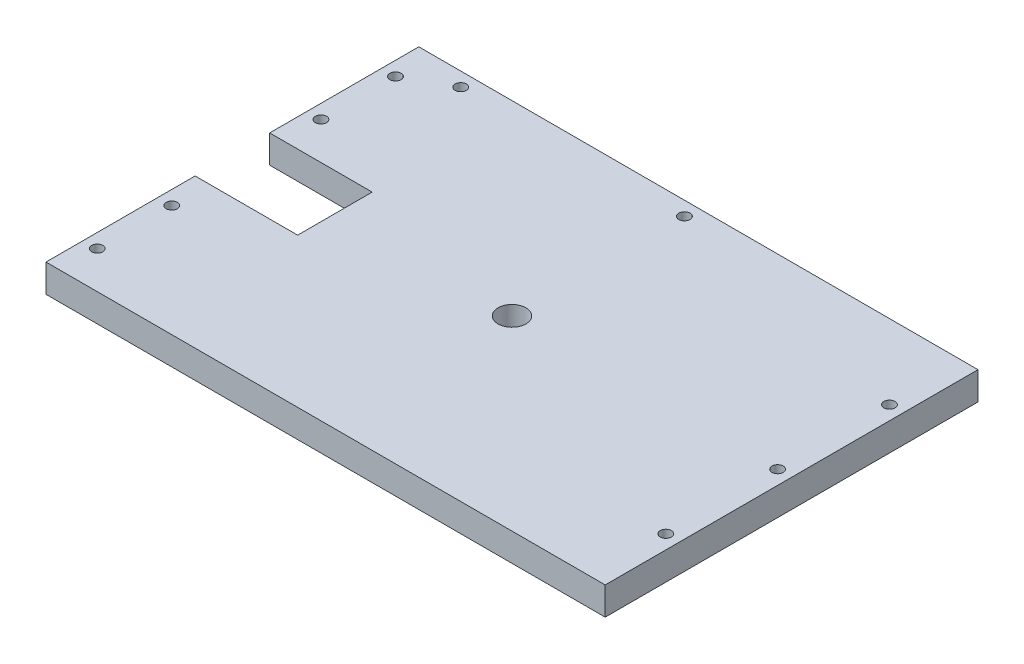
from build123d import *

# Parameters (mm, degrees)
SKETCH2_R           = 7.5
SKETCH2_R_2         = 3
BOSS_EXTRUDE2_DEPTH = 15


with BuildPart() as part:
    # Sketch2 → Boss-Extrude2 (new body)
    with BuildSketch(Plane(origin=(0, 0, 0), x_dir=(1, 0, 0), z_dir=(0, 1, 0))):
        Polygon((-168.032786885, 40.573770492), (131.967213115, 40.573770492), (131.967213115, -159.426229508), (-168.032786885, -159.426229508), (-168.032786885, -79.426229508), (-113.032786885, -79.426229508), (-113.032786885, -39.426229508), (-168.032786885, -39.426229508), align=None)
        with Locations(Location((-18.032786885, -59.426229508, 0), (0, 0, 270))):
            Circle(SKETCH2_R, mode=Mode.SUBTRACT)
        with Locations(Location((-160.532786885, 20.573770492, 0), (0, 0, 270))):
            Circle(SKETCH2_R_2, mode=Mode.SUBTRACT)
        with Locations(Location((-160.532786885, -19.426229508, 0), (0, 0, 90))):
            Circle(SKETCH2_R_2, mode=Mode.SUBTRACT)
        with Locations(Location((-160.532786885, -139.426229508, 0), (0, 0, 270))):
            Circle(SKETCH2_R_2, mode=Mode.SUBTRACT)
        with Locations(Location((-160.532786885, -99.426229508, 0), (0, 0, 90))):
            Circle(SKETCH2_R_2, mode=Mode.SUBTRACT)
        with Locations(Location((124.467213115, -119.426229508, 0), (0, 0, 270))):
            Circle(SKETCH2_R_2, mode=Mode.SUBTRACT)
        with Locations(Location((124.467213115, 0.573770492, 0), (0, 0, 90))):
            Circle(SKETCH2_R_2, mode=Mode.SUBTRACT)
        with Locations(Location((124.467213115, -59.426229508, 0), (0, 0, 270))):
            Circle(SKETCH2_R_2, mode=Mode.SUBTRACT)
        with Locations(Location((-18.032786885, 33.073770492, 0), (0, 0, 270))):
            Circle(SKETCH2_R_2, mode=Mode.SUBTRACT)
        with Locations(Location((-138.032786885, 33.073770492, 0), (0, 0, 270))):
            Circle(SKETCH2_R_2, mode=Mode.SUBTRACT)
    extrude(amount=BOSS_EXTRUDE2_DEPTH)


solid = part.part
